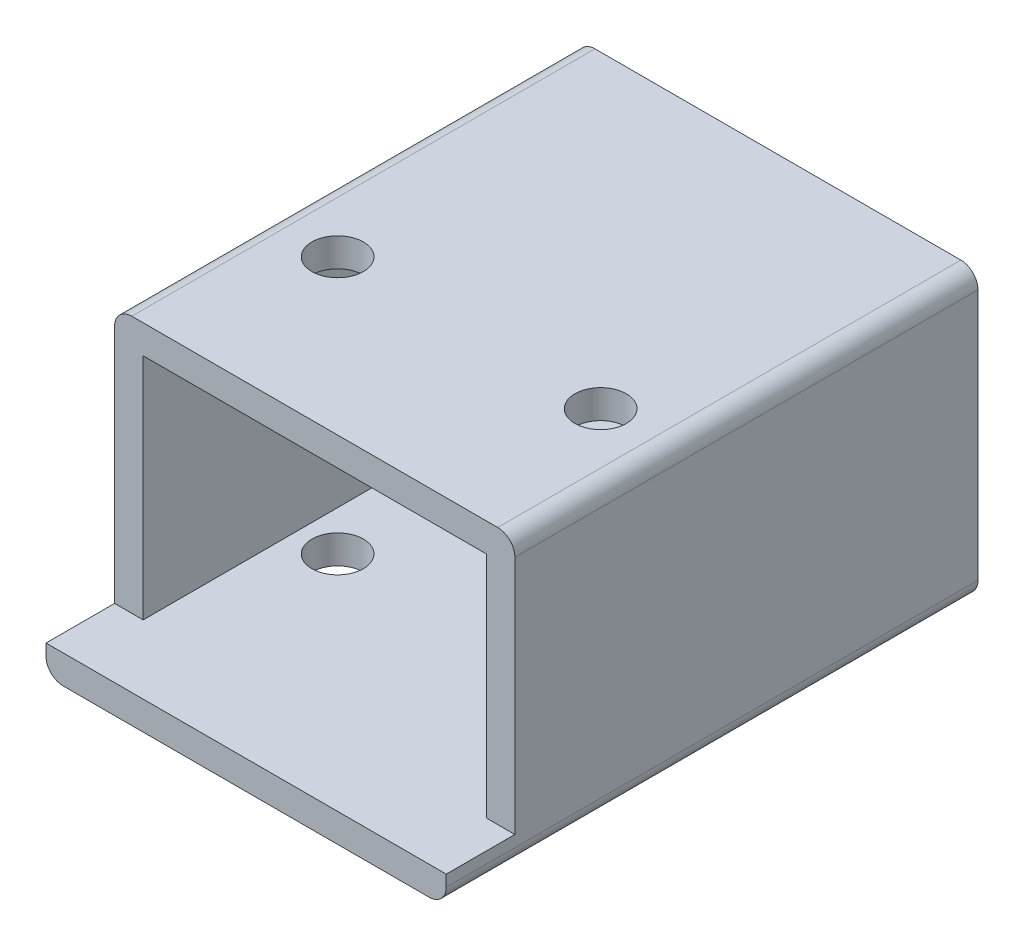
from build123d import *

# Parameters (mm, degrees)
SKETCH1_W                                   = 70
SKETCH1_H                                   = 50
BOSS_EXTRUDE1_DEPTH                         = 5
SKETCH2_W                                   = 70
SKETCH2_H                                   = 5
BOSS_EXTRUDE2_DEPTH                         = 88
BOSS_EXTRUDE3_DEPTH                         = 76
SKETCH4_R                                   = 4.5
CUT_EXTRUDE1_DEPTH                          = 56
FILLET1_R                                   = 3
CBORE_FOR_M4_HEX_HEAD_CAP_SCREW1_AT_2_COUNT = 2
CBORE_FOR_M4_HEX_HEAD_CAP_SCREW1_AT_2_PITCH = 22
CBORE_FOR_M4_HEX_HEAD_CAP_SCREW1_AT_3_COUNT = 2
CBORE_FOR_M4_HEX_HEAD_CAP_SCREW1_AT_3_PITCH = 43.9089968
CBORE_FOR_M4_HEX_HEAD_CAP_SCREW1_AT_4_COUNT = 2
CBORE_FOR_M4_HEX_HEAD_CAP_SCREW1_AT_4_PITCH = 38


with BuildPart() as part:
    # Sketch1 → Boss-Extrude1 (new body)
    with BuildSketch(Plane.XY):
        Rectangle(SKETCH1_W, SKETCH1_H)
    extrude(amount=BOSS_EXTRUDE1_DEPTH)

    # Sketch2 → Boss-Extrude2 (add)
    with BuildSketch(Plane.XY.offset(5)):
        with Locations((0, -22.5)):
            Rectangle(SKETCH2_W, SKETCH2_H)
    extrude(amount=BOSS_EXTRUDE2_DEPTH)

    # Sketch3 → Boss-Extrude3 (add)
    with BuildSketch(Plane.XY.offset(5)):
        Polygon((-35, 25), (35, 25), (35, 20), (35, -20), (30, -20), (30, 20), (-30, 20), (-30, -20), (-35, -20), (-35, 20), align=None)
    extrude(amount=BOSS_EXTRUDE3_DEPTH)

    # Sketch4 → Cut-Extrude1 (cut)
    with BuildSketch(Plane(origin=(0, 25, 0), x_dir=(1, 0, 0), z_dir=(0, 1, 0))):
        with Locations(Location((23, -54, 0), (0, 0, 270))):
            Circle(SKETCH4_R)
        with Locations(Location((-23, -54, 0), (0, 0, 270))):
            Circle(SKETCH4_R)
    extrude(amount=-CUT_EXTRUDE1_DEPTH, mode=Mode.SUBTRACT)

    # Fillet1
    fillet1_edges = [part.edges().sort_by_distance(p)[0] for p in [
        (-35, 25, 40.5),
        (35, 25, 40.5),
        (35, -25, 46.5),
        (-35, -25, 46.5),
    ]]
    fillet(fillet1_edges, radius=FILLET1_R)

    # Sketch7 → CBORE for M4 Hex Head Cap Screw1 (revolve, cut)
    with BuildSketch(Plane(origin=(-19, -11, 5), x_dir=(0, -1, 0), z_dir=(1, 0, 0))):
        Polygon((0, 0), (0, 12.4), (2.25, 11.048063607), (2.25, 2.8), (5.5415, 2.8), (5.5415, 0.025), (5.5665, 0), align=None)
    cbore_for_m4_hex_head_cap_screw1 = revolve(axis=Axis((-19, -11, 11.35), (0, 0, -1)), mode=Mode.SUBTRACT)

    # CBORE for M4 Hex Head Cap Screw1 at 2: CBORE for M4 Hex Head Cap Screw1 ×2
    with Locations(*[(0, i * CBORE_FOR_M4_HEX_HEAD_CAP_SCREW1_AT_2_PITCH, 0) for i in range(1, CBORE_FOR_M4_HEX_HEAD_CAP_SCREW1_AT_2_COUNT)]):
        add(cbore_for_m4_hex_head_cap_screw1, mode=Mode.SUBTRACT)

    # CBORE for M4 Hex Head Cap Screw1 at 3: CBORE for M4 Hex Head Cap Screw1 ×2
    with Locations(*[Vector(0.8654262854811263, 0.5010362705417046, 0) * (i * CBORE_FOR_M4_HEX_HEAD_CAP_SCREW1_AT_3_PITCH) for i in range(1, CBORE_FOR_M4_HEX_HEAD_CAP_SCREW1_AT_3_COUNT)]):
        add(cbore_for_m4_hex_head_cap_screw1, mode=Mode.SUBTRACT)

    # CBORE for M4 Hex Head Cap Screw1 at 4: CBORE for M4 Hex Head Cap Screw1 ×2
    with Locations(*[(i * CBORE_FOR_M4_HEX_HEAD_CAP_SCREW1_AT_4_PITCH, 0, 0) for i in range(1, CBORE_FOR_M4_HEX_HEAD_CAP_SCREW1_AT_4_COUNT)]):
        add(cbore_for_m4_hex_head_cap_screw1, mode=Mode.SUBTRACT)


solid = part.part
